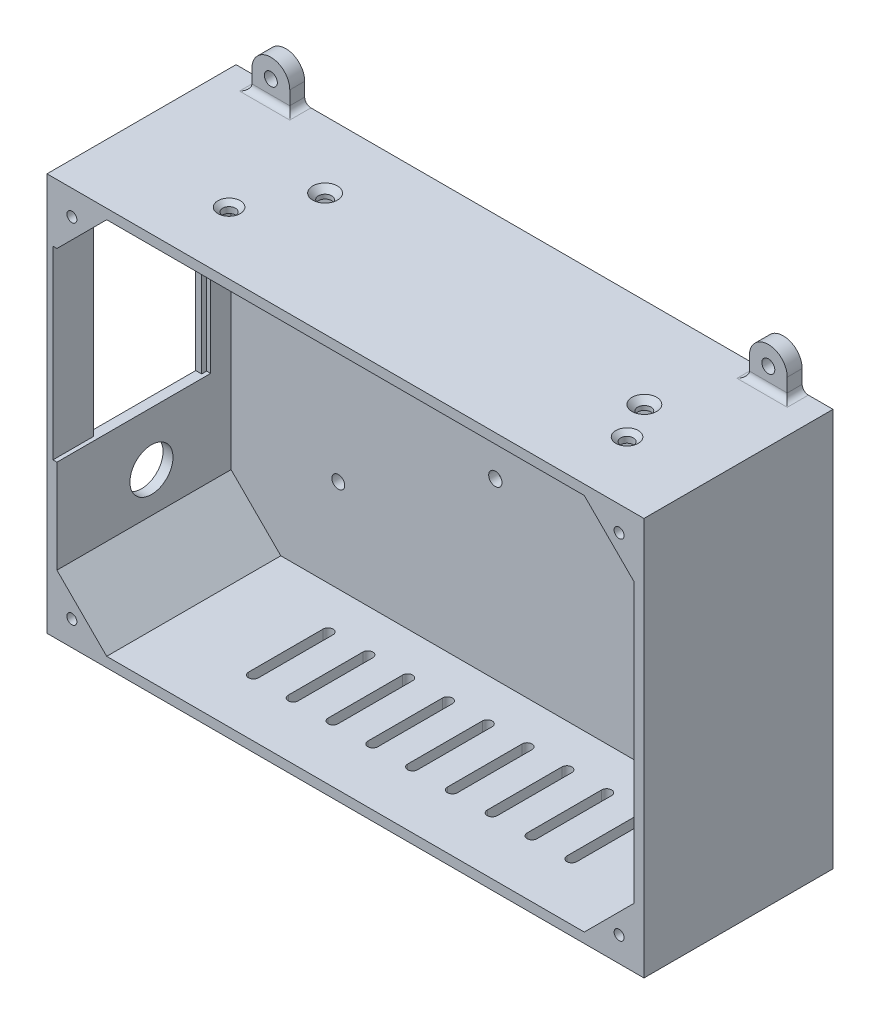
from build123d import *

# Parameters (mm, degrees)
SKETCH1_W                                         = 152.4
SKETCH1_H                                         = 101.6
BOSS_EXTRUDE1_DEPTH                               = 3.81
SKETCH2_W                                         = 152.4
SKETCH2_H                                         = 101.6
SKETCH2_W_2                                       = 147.32
SKETCH2_H_2                                       = 96.52
BOSS_EXTRUDE2_DEPTH                               = 44.45
BOSS_EXTRUDE3_DEPTH                               = 44.45
CUT_EXTRUDE1_START                                = 28.575
SKETCH3_3_R                                       = 1.27
CUT_EXTRUDE1_DEPTH                                = 15.875
MIRROR2_COPY_1_DEPTH                              = 44.45
MIRROR2_START                                     = 28.575
MIRROR2_COPY_2_SKETCH_R                           = 1.27
MIRROR2_COPY_2_DEPTH                              = 15.875
CUT_EXTRUDE2_REACH                                = 191.413
SKETCH6_R                                         = 5.5
SKETCH6_W                                         = 27.686
SKETCH6_H                                         = 47.244
SKETCH7_W                                         = 1.016
SKETCH7_H                                         = 47.244
CUT_EXTRUDE3_DEPTH                                = 39.243
SKETCH8_R                                         = 1.651
BOSS_EXTRUDE4_DEPTH                               = 3.81
FILLET1_R                                         = 1.5875
FILLET1_OF_MIRROR5_R                              = 1.5875
CUT_EXTRUDE4_REACH                                = 196.906
LPATTERN1_COUNT                                   = 9
LPATTERN1_PITCH                                   = 10.16
CSK_FOR_M3_FLAT_HEAD_MACHINE_SCREW1_D             = 3.4
CSK_FOR_M3_FLAT_HEAD_MACHINE_SCREW1_DEPTH         = 6.35
CSK_FOR_M3_FLAT_HEAD_MACHINE_SCREW1_CSINK_D       = 6.3
CSK_FOR_M3_FLAT_HEAD_MACHINE_SCREW1_CSINK_ANGLE   = 90
CSK_FOR_M3_FLAT_HEAD_MACHINE_SCREW1_TIP           = 1.021463052
CSK_FOR_M3_FLAT_HEAD_MACHINE_SCREW2_D             = 3.4
CSK_FOR_M3_FLAT_HEAD_MACHINE_SCREW2_DEPTH         = 6.35
CSK_FOR_M3_FLAT_HEAD_MACHINE_SCREW2_CSINK_D       = 6.3
CSK_FOR_M3_FLAT_HEAD_MACHINE_SCREW2_CSINK_ANGLE   = 90
CSK_FOR_M3_FLAT_HEAD_MACHINE_SCREW2_TIP           = 1.021463052
CSK_FOR_4_FLAT_HEAD_MACHINE_SCREW_100_D           = 3.2639
CSK_FOR_4_FLAT_HEAD_MACHINE_SCREW_100_DEPTH       = 6.35
CSK_FOR_4_FLAT_HEAD_MACHINE_SCREW_100_CSINK_D     = 5.715
CSK_FOR_4_FLAT_HEAD_MACHINE_SCREW_100_CSINK_ANGLE = 100
CSK_FOR_4_FLAT_HEAD_MACHINE_SCREW_100_TIP         = 0.980574487
CSK_FOR_4_FLAT_HEAD_MACHINE_SCREW_2_D             = 3.2639
CSK_FOR_4_FLAT_HEAD_MACHINE_SCREW_2_DEPTH         = 6.35
CSK_FOR_4_FLAT_HEAD_MACHINE_SCREW_2_CSINK_D       = 5.715
CSK_FOR_4_FLAT_HEAD_MACHINE_SCREW_2_CSINK_ANGLE   = 100
CSK_FOR_4_FLAT_HEAD_MACHINE_SCREW_2_TIP           = 0.980574487


with BuildPart() as part:
    # Sketch1 → Boss-Extrude1 (new body)
    with BuildSketch(Plane.XY):
        with Locations((76.2, 50.8)):
            Rectangle(SKETCH1_W, SKETCH1_H)
    extrude(amount=BOSS_EXTRUDE1_DEPTH)

    # Sketch2 → Boss-Extrude2 (add)
    with BuildSketch(Plane.XY.offset(3.81)):
        with Locations((76.2, 50.8)):
            Rectangle(SKETCH2_W, SKETCH2_H)
        with Locations((76.2, 50.8)):
            Rectangle(SKETCH2_W_2, SKETCH2_H_2, mode=Mode.SUBTRACT)
    extrude(amount=BOSS_EXTRUDE2_DEPTH)

    # Sketch3 → Boss-Extrude3 (add)
    with BuildSketch(Plane.XY.offset(3.81)):
        Polygon((137.16, 99.06), (149.86, 86.36), (149.86, 99.06), align=None)
    boss_extrude3 = extrude(amount=BOSS_EXTRUDE3_DEPTH)

    # Sketch3<3> → Cut-Extrude1 (cut)
    with BuildSketch(Plane.XY.offset(3.81).offset(CUT_EXTRUDE1_START)):
        with Locations((146.05, 95.25)):
            Circle(SKETCH3_3_R)
    cut_extrude1 = extrude(amount=CUT_EXTRUDE1_DEPTH, mode=Mode.SUBTRACT)

    # Mirror1: Boss-Extrude3, Cut-Extrude1 across plane
    add(boss_extrude3.mirror(Plane(origin=(76.2, 0, 0), x_dir=(0, 0, 1), z_dir=(1, 0, 0))))
    add(cut_extrude1.mirror(Plane(origin=(76.2, 0, 0), x_dir=(0, 0, 1), z_dir=(1, 0, 0))), mode=Mode.SUBTRACT)

    # Mirror2: Boss-Extrude3, Cut-Extrude1 across plane
    add(boss_extrude3.mirror(Plane(origin=(0, 50.8, 0), x_dir=(0, 0, 1), z_dir=(0, -1, 0))))
    add(cut_extrude1.mirror(Plane(origin=(0, 50.8, 0), x_dir=(0, 0, 1), z_dir=(0, -1, 0))), mode=Mode.SUBTRACT)

    # Mirror2 copy 1 sketch → Mirror2 copy 1 (add)
    with BuildSketch(Plane(origin=(152.4, 101.6, 3.81), x_dir=(-1, 0, 0), z_dir=(0, 0, 1))):
        Polygon((137.16, 99.06), (149.86, 86.36), (149.86, 99.06), align=None)
    extrude(amount=MIRROR2_COPY_1_DEPTH)

    # Mirror2 copy 2 sketch → Mirror2 copy 2 (cut)
    with BuildSketch(Plane(origin=(152.4, 101.6, 3.81), x_dir=(-1, 0, 0), z_dir=(0, 0, 1)).offset(MIRROR2_START)):
        with Locations((146.05, 95.25)):
            Circle(MIRROR2_COPY_2_SKETCH_R)
    extrude(amount=MIRROR2_COPY_2_DEPTH, mode=Mode.SUBTRACT)

    # Sketch6 → Cut-Extrude2 (cut, up to next)
    with BuildSketch(Plane.ZY, mode=Mode.PRIVATE) as cut_extrude2_sk1:
        with Locations((24.13, 25.4)):
            Circle(SKETCH6_R)
    cut_extrude2_tool1 = extrude(cut_extrude2_sk1.sketch, amount=-CUT_EXTRUDE2_REACH, mode=Mode.PRIVATE) & part.part
    # Sketch6 → Cut-Extrude2 (cut, up to next)
    with BuildSketch(Plane.ZY, mode=Mode.PRIVATE) as cut_extrude2_sk2:
        with Locations((24.13, 62.738)):
            Rectangle(SKETCH6_W, SKETCH6_H)
    cut_extrude2_tool2 = extrude(cut_extrude2_sk2.sketch, amount=-CUT_EXTRUDE2_REACH, mode=Mode.PRIVATE) & part.part
    add(cut_extrude2_tool1.solids().sort_by_distance((0, 25.4, 24.13))[0], mode=Mode.SUBTRACT)
    add(cut_extrude2_tool2.solids().sort_by_distance((0, 62.738, 24.13))[0], mode=Mode.SUBTRACT)

    # Sketch7 → Cut-Extrude3 (cut)
    with BuildSketch(Plane.XY.offset(48.26)):
        with Locations((2.032, 62.738)):
            Rectangle(SKETCH7_W, SKETCH7_H)
    extrude(amount=-CUT_EXTRUDE3_DEPTH, mode=Mode.SUBTRACT)

    # Sketch8 → Boss-Extrude4 (add)
    # profile 1 of 2: a face of its own
    with BuildSketch(Plane(origin=(0, 0, 0), x_dir=(-1, 0, 0), z_dir=(0, 0, -1))):
        with BuildLine():
            Line((-144.526, 106.68), (-144.526, 101.6))
            Line((-144.526, 101.6), (-134.874, 101.6))
            Line((-134.874, 101.6), (-134.874, 106.68))
            ThreePointArc((-134.874, 106.68), (-139.7, 111.506), (-144.526, 106.68))
        make_face()
        with Locations((-139.7, 106.68)):
            Circle(SKETCH8_R, mode=Mode.SUBTRACT)
    # profile 2 of 2: a face of its own
    with BuildSketch(Plane(origin=(0, 0, 0), x_dir=(-1, 0, 0), z_dir=(0, 0, -1))):
        with BuildLine():
            Line((-134.874, 0), (-134.874, -5.08))
            ThreePointArc((-134.874, -5.08), (-139.7, -9.906), (-144.526, -5.08))
            Line((-144.526, -5.08), (-144.526, 0))
            Line((-144.526, 0), (-134.874, 0))
        make_face()
        with Locations((-139.7, -5.08)):
            Circle(SKETCH8_R, mode=Mode.SUBTRACT)
    boss_extrude4 = extrude(amount=-BOSS_EXTRUDE4_DEPTH)

    # Fillet1
    fillet1_edges = [part.edges().sort_by_distance(p)[0] for p in [
        (139.7, 101.6, 3.81),
        (134.874, 101.6, 1.905),
        (144.526, 101.6, 1.905),
        (139.7, 0, 3.81),
        (144.526, 0, 1.905),
        (134.874, 0, 1.905),
    ]]
    fillet(fillet1_edges, radius=FILLET1_R)

    # Mirror5: Boss-Extrude4 across plane
    add(boss_extrude4.mirror(Plane(origin=(76.2, 0, 0), x_dir=(0, 0, 1), z_dir=(1, 0, 0))))

    # Fillet1 of Mirror5
    fillet1_of_mirror5_edges = [part.edges().sort_by_distance(p)[0] for p in [
        (12.7, 101.6, 3.81),
        (17.526, 101.6, 1.905),
        (7.874, 101.6, 1.905),
        (12.7, 0, 3.81),
        (7.874, 0, 1.905),
        (17.526, 0, 1.905),
    ]]
    fillet(fillet1_of_mirror5_edges, radius=FILLET1_OF_MIRROR5_R)

    # Sketch9 → Cut-Extrude4 (cut, up to next)
    with BuildSketch(Plane.XZ, mode=Mode.PRIVATE) as cut_extrude4_sk1:
        with BuildLine():
            Line((39.37, 33.655), (39.37, 14.605))
            ThreePointArc((39.37, 14.605), (38.1, 13.335), (36.83, 14.605))
            Line((36.83, 14.605), (36.83, 33.655))
            ThreePointArc((36.83, 33.655), (38.1, 34.925), (39.37, 33.655))
        make_face()
    cut_extrude4_tool1 = extrude(cut_extrude4_sk1.sketch, amount=-CUT_EXTRUDE4_REACH, mode=Mode.PRIVATE) & part.part
    cut_extrude4 = cut_extrude4_tool1.solids().sort_by_distance((38.1, 0, 24.13))[0]
    add(cut_extrude4, mode=Mode.SUBTRACT)

    # LPattern1: Cut-Extrude4 ×9
    with Locations(*[(i * LPATTERN1_PITCH, 0, 0) for i in range(1, LPATTERN1_COUNT)]):
        add(cut_extrude4, mode=Mode.SUBTRACT)

    # CSK for M3 Flat Head Machine Screw1
    with Locations(Plane(origin=(0, 0, 0), x_dir=(-1, 0, 0), z_dir=(0, 0, -1))):
        with Locations((-70.0024, 74.6252), (-70.0024, 46.9392), (-105.8164, 46.9392)):
            CounterSinkHole(CSK_FOR_M3_FLAT_HEAD_MACHINE_SCREW1_D / 2, CSK_FOR_M3_FLAT_HEAD_MACHINE_SCREW1_CSINK_D / 2, depth=CSK_FOR_M3_FLAT_HEAD_MACHINE_SCREW1_DEPTH, counter_sink_angle=CSK_FOR_M3_FLAT_HEAD_MACHINE_SCREW1_CSINK_ANGLE)
            with Locations((0, 0, -(CSK_FOR_M3_FLAT_HEAD_MACHINE_SCREW1_DEPTH + CSK_FOR_M3_FLAT_HEAD_MACHINE_SCREW1_TIP / 2))):  # 118° drill point
                Cone(0, CSK_FOR_M3_FLAT_HEAD_MACHINE_SCREW1_D / 2, CSK_FOR_M3_FLAT_HEAD_MACHINE_SCREW1_TIP, mode=Mode.SUBTRACT)

    # CSK for M3 Flat Head Machine Screw2
    with Locations(Plane(origin=(0, 101.6, 0), x_dir=(1, 0, 0), z_dir=(0, 1, 0))):
        with Locations((39.751, -17.018), (127.2286, -22.987)):
            CounterSinkHole(CSK_FOR_M3_FLAT_HEAD_MACHINE_SCREW2_D / 2, CSK_FOR_M3_FLAT_HEAD_MACHINE_SCREW2_CSINK_D / 2, depth=CSK_FOR_M3_FLAT_HEAD_MACHINE_SCREW2_DEPTH, counter_sink_angle=CSK_FOR_M3_FLAT_HEAD_MACHINE_SCREW2_CSINK_ANGLE)
            with Locations((0, 0, -(CSK_FOR_M3_FLAT_HEAD_MACHINE_SCREW2_DEPTH + CSK_FOR_M3_FLAT_HEAD_MACHINE_SCREW2_TIP / 2))):  # 118° drill point
                Cone(0, CSK_FOR_M3_FLAT_HEAD_MACHINE_SCREW2_D / 2, CSK_FOR_M3_FLAT_HEAD_MACHINE_SCREW2_TIP, mode=Mode.SUBTRACT)

    # CSK for _4 Flat Head Machine Screw _100
    with Locations(Plane(origin=(0, 101.6, 0), x_dir=(1, 0, 0), z_dir=(0, 1, 0))):
        with Locations((30.6197, -32.3977), (132.2197, -32.3977)):
            CounterSinkHole(CSK_FOR_4_FLAT_HEAD_MACHINE_SCREW_100_D / 2, CSK_FOR_4_FLAT_HEAD_MACHINE_SCREW_100_CSINK_D / 2, depth=CSK_FOR_4_FLAT_HEAD_MACHINE_SCREW_100_DEPTH, counter_sink_angle=CSK_FOR_4_FLAT_HEAD_MACHINE_SCREW_100_CSINK_ANGLE)
            with Locations((0, 0, -(CSK_FOR_4_FLAT_HEAD_MACHINE_SCREW_100_DEPTH + CSK_FOR_4_FLAT_HEAD_MACHINE_SCREW_100_TIP / 2))):  # 118° drill point
                Cone(0, CSK_FOR_4_FLAT_HEAD_MACHINE_SCREW_100_D / 2, CSK_FOR_4_FLAT_HEAD_MACHINE_SCREW_100_TIP, mode=Mode.SUBTRACT)

    # CSK for _4 Flat Head Machine Screw _ 2
    with Locations(Plane(origin=(0, 0, 0), x_dir=(-1, 0, 0), z_dir=(0, 0, -1))):
        with Locations((-29.9085, 26.2255), (-132.3721, 93.3323)):
            CounterSinkHole(CSK_FOR_4_FLAT_HEAD_MACHINE_SCREW_2_D / 2, CSK_FOR_4_FLAT_HEAD_MACHINE_SCREW_2_CSINK_D / 2, depth=CSK_FOR_4_FLAT_HEAD_MACHINE_SCREW_2_DEPTH, counter_sink_angle=CSK_FOR_4_FLAT_HEAD_MACHINE_SCREW_2_CSINK_ANGLE)
            with Locations((0, 0, -(CSK_FOR_4_FLAT_HEAD_MACHINE_SCREW_2_DEPTH + CSK_FOR_4_FLAT_HEAD_MACHINE_SCREW_2_TIP / 2))):  # 118° drill point
                Cone(0, CSK_FOR_4_FLAT_HEAD_MACHINE_SCREW_2_D / 2, CSK_FOR_4_FLAT_HEAD_MACHINE_SCREW_2_TIP, mode=Mode.SUBTRACT)


solid = part.part
